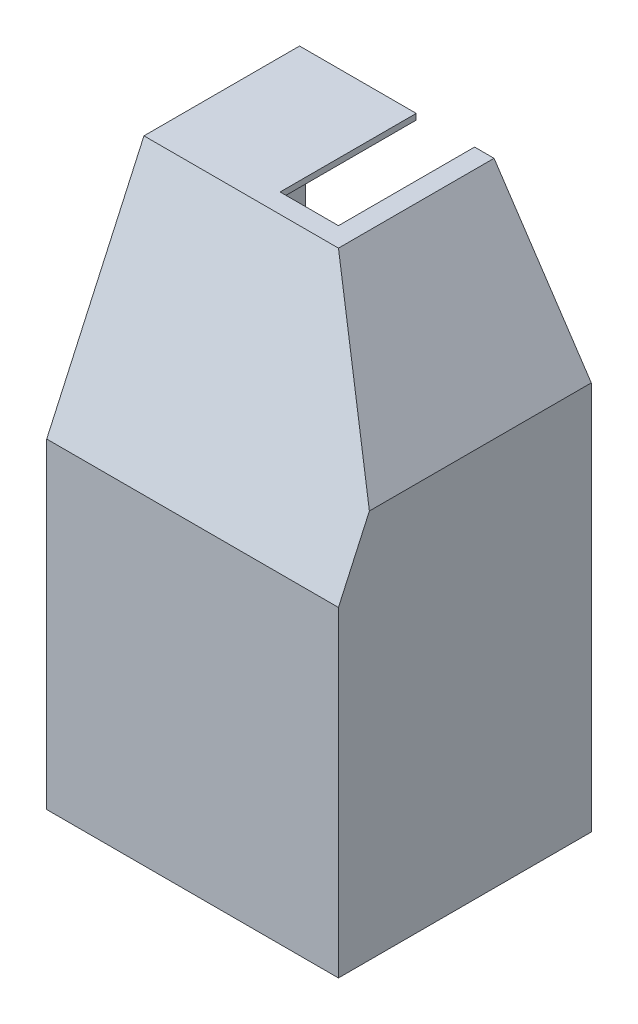
from build123d import *

# Parameters (mm, degrees)
EXTRUDE_1_DEPTH     = 130
CHAMFER_1_SIZE      = 50
CHAMFER_1_SIZE2     = 110
SHELL_1_T           = -3
SKETCH_3_W          = 30
SKETCH_3_H          = 70
CUT_EXTRUDE_1_DEPTH = 3


with BuildPart() as part:
    # 草图2 → 凸台-拉伸1 (new body)
    with BuildSketch(Plane.XY):
        Polygon((-75, 280), (-75, 5), (75, 5), (75, 205), (25, 280), align=None)
    extrude(amount=EXTRUDE_1_DEPTH)

    # 倒角1
    chamfer_1_edges = [part.edges().sort_by_distance(p)[0] for p in [
        (-25, 280, 130),
    ]]
    chamfer_1_side = [part.faces().sort_by_distance(p)[0] for p in [
        (-25, 280, 65),
    ]]
    chamfer(chamfer_1_edges, length=CHAMFER_1_SIZE, length2=CHAMFER_1_SIZE2, reference=chamfer_1_side[0])

    # 抽壳1
    shell_1_openings = [part.faces().sort_by_distance(p)[0] for p in [
        (-2.777777778, 137.142857143, 0),
    ]]
    offset(amount=SHELL_1_T, openings=shell_1_openings, kind=Kind.INTERSECTION)

    # 草图3 → 切除-拉伸1 (cut)
    with BuildSketch(Plane(origin=(0, 280, 0), x_dir=(1, 0, 0), z_dir=(0, 1, 0))):
        with Locations((0, -35)):
            Rectangle(SKETCH_3_W, SKETCH_3_H)
    extrude(amount=-CUT_EXTRUDE_1_DEPTH, mode=Mode.SUBTRACT)


solid = part.part
